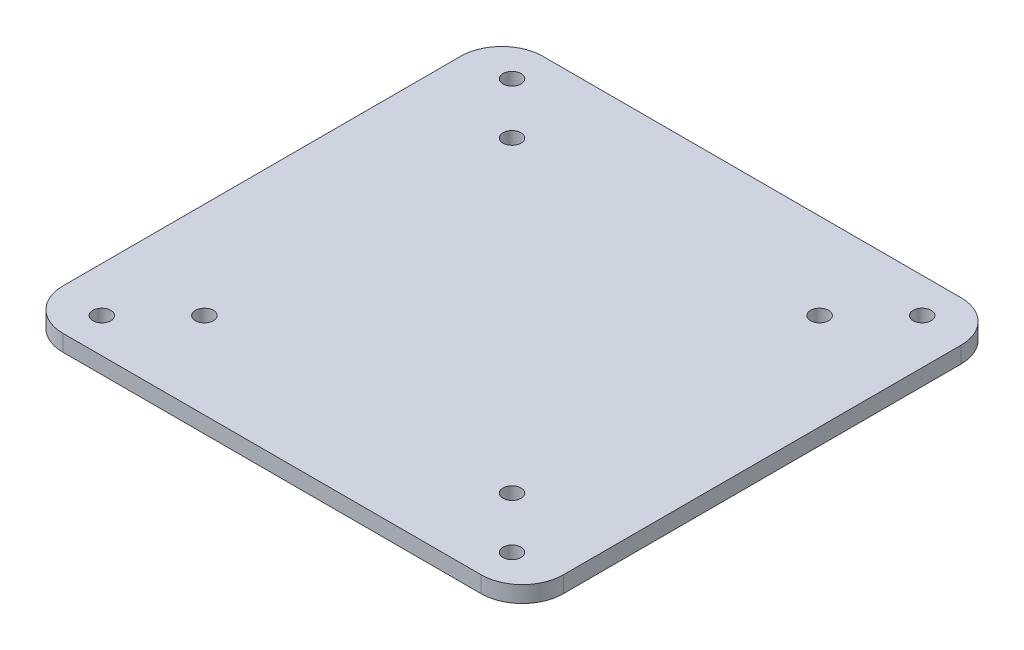
from build123d import *

# Parameters (mm, degrees)
SKETCH1_W           = 122
SKETCH1_H           = 117
SKETCH1_R           = 2.2
BOSS_EXTRUDE1_DEPTH = 4
FILLET1_R           = 10


with BuildPart() as part:
    # Sketch1 → Boss-Extrude1 (new body)
    with BuildSketch(Plane(origin=(0, 0, 0), x_dir=(1, 0, 0), z_dir=(0, 1, 0))):
        with Locations((61, 58.5)):
            Rectangle(SKETCH1_W, SKETCH1_H)
        with Locations(Location((111, 108.5, 0), (0, 0, 270))):
            Circle(SKETCH1_R, mode=Mode.SUBTRACT)
        with Locations(Location((11, 108.5, 0), (0, 0, 270))):
            Circle(SKETCH1_R, mode=Mode.SUBTRACT)
        with Locations(Location((11, 8.5, 0), (0, 0, 270))):
            Circle(SKETCH1_R, mode=Mode.SUBTRACT)
        with Locations(Location((111, 8.5, 0), (0, 0, 270))):
            Circle(SKETCH1_R, mode=Mode.SUBTRACT)
        with Locations(Location((98.5, 96, 0), (0, 0, 270))):
            Circle(SKETCH1_R, mode=Mode.SUBTRACT)
        with Locations(Location((23.5, 96, 0), (0, 0, 270))):
            Circle(SKETCH1_R, mode=Mode.SUBTRACT)
        with Locations(Location((23.5, 21, 0), (0, 0, 270))):
            Circle(SKETCH1_R, mode=Mode.SUBTRACT)
        with Locations(Location((98.5, 21, 0), (0, 0, 270))):
            Circle(SKETCH1_R, mode=Mode.SUBTRACT)
    extrude(amount=BOSS_EXTRUDE1_DEPTH)

    # Fillet1
    fillet1_edges = [part.edges().sort_by_distance(p)[0] for p in [
        (0, 2, -117),
        (122, 2, -117),
        (122, 2, 0),
        (0, 2, 0),
    ]]
    fillet(fillet1_edges, radius=FILLET1_R)


solid = part.part
